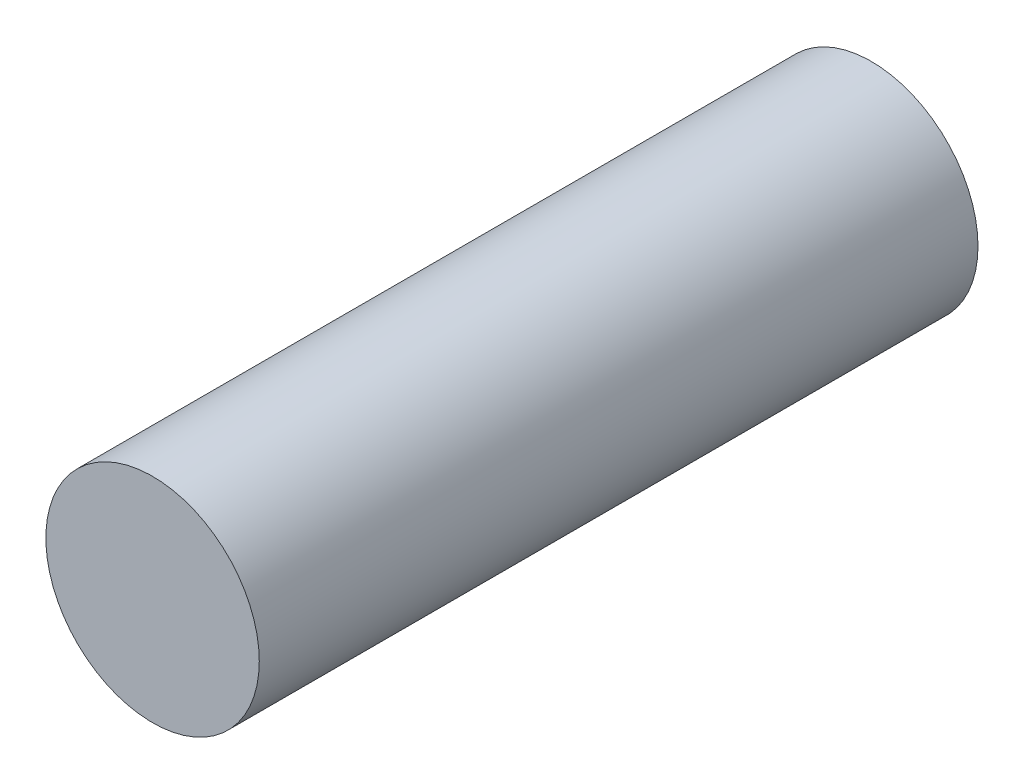
from build123d import *

# Parameters (mm, degrees)
SKETCH3_R           = 12.446
BOSS_EXTRUDE1_DEPTH = 83.82


with BuildPart() as part:
    # Sketch3 → Boss-Extrude1 (new body)
    with BuildSketch(Plane.XY):
        with Locations((-14.965309324, 8.775113195)):
            Circle(SKETCH3_R)
    extrude(amount=BOSS_EXTRUDE1_DEPTH)


solid = part.part
